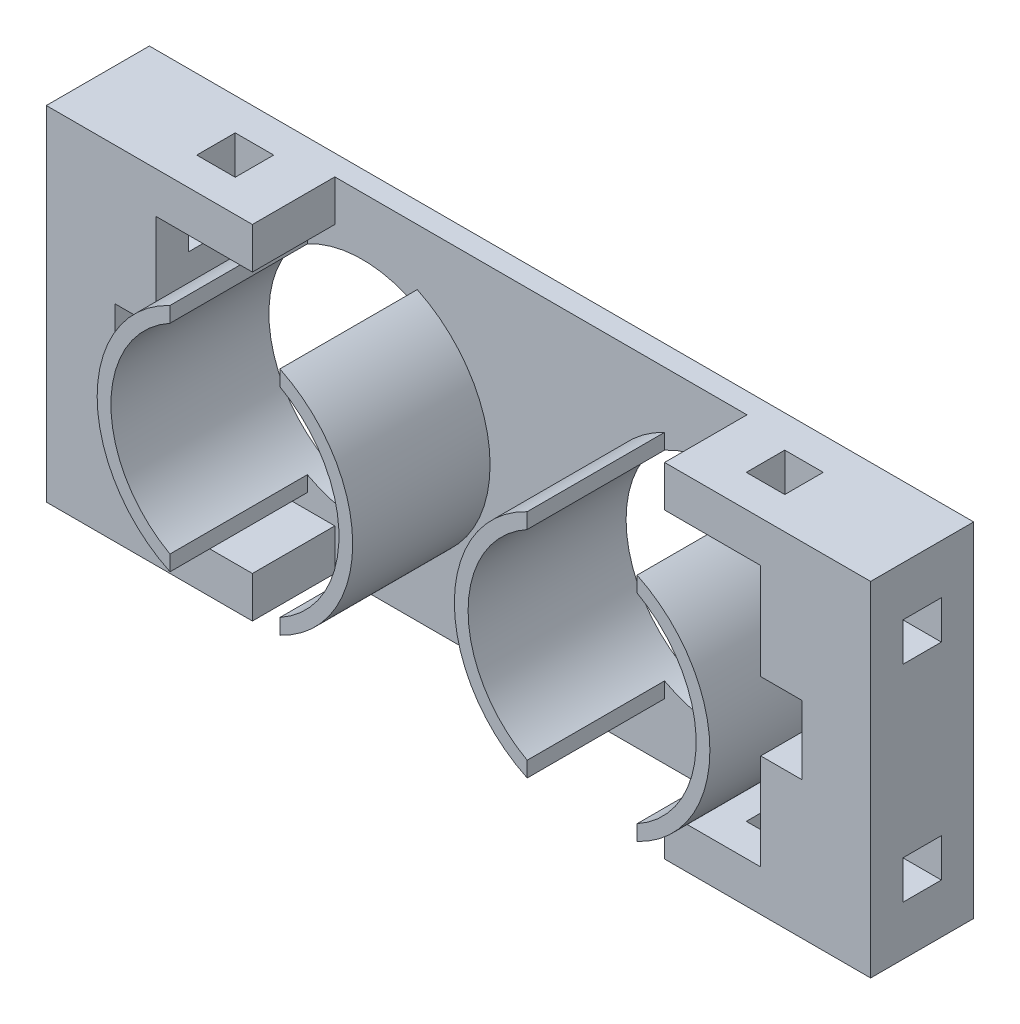
from build123d import *
from build123d.topology import SkipClean

# Parameters (mm, degrees)
ESBO_O1_R                = 8.3
RESSALTO_EXTRUS_O1_DEPTH = 1.5
RESSALTO_EXTRUS_O2_DEPTH = 6
ESBO_O3_W                = 2.8
ESBO_O3_H                = 2.8
CORTE_EXTRUS_O1_DEPTH    = 37.142080737
ESBO_O4_W                = 2.8
ESBO_O4_H                = 2.8
CORTE_EXTRUS_O2_DEPTH    = 53.08166664
ESBO_O6_W                = 5
ESBO_O6_H                = 25
RESSALTO_EXTRUS_O5_DEPTH = 7.5
ESBO_O7_W                = 2.8
ESBO_O7_H                = 2.8
CORTE_EXTRUS_O3_DEPTH    = 60
RESSALTO_EXTRUS_O3_DEPTH = 10


with BuildPart() as part:
    # Esboço1 → Ressalto-extrusão1 (new body)
    with BuildSketch(Plane.XY):
        Polygon((-25, -12.5), (-25, 12.5), (25, 12.5), (25, -12.5), (15, -12.5), (-15, -12.5), align=None)
        with Locations((-13, 0)):
            Circle(ESBO_O1_R, mode=Mode.SUBTRACT)
        with Locations(Location((13, 0, 0), (0, 0, 180))):
            Circle(ESBO_O1_R, mode=Mode.SUBTRACT)
    extrude(amount=RESSALTO_EXTRUS_O1_DEPTH)

    # Esboço2 → Ressalto-extrusão2 (add)
    with BuildSketch(Plane.XY.offset(1.5)):
        Polygon((-20, -12.5), (-25, -12.5), (-25, -2.5), (-22, -2.5), (-22, -9.5), (-15, -9.5), (-15, -12.5), align=None)
        Polygon((22, -2.5), (22, -9.5), (15, -9.5), (15, -12.5), (20, -12.5), (25, -12.5), (25, -2.5), align=None)
        Polygon((20, 12.5), (25, 12.5), (25, 2.5), (22, 2.5), (22, 9.5), (15, 9.5), (15, 12.5), align=None)
        Polygon((-22, 2.5), (-22, 9.5), (-15, 9.5), (-15, 12.5), (-20, 12.5), (-25, 12.5), (-25, 2.5), align=None)
    extrude(amount=RESSALTO_EXTRUS_O2_DEPTH)

    # Esboço3 → Corte-extrusão1 (cut, through all)
    with BuildSketch(Plane.XZ.offset(12.5)):
        with Locations((-20, 3.75)):
            Rectangle(ESBO_O3_W, ESBO_O3_H)
        with Locations((20, 3.75)):
            Rectangle(ESBO_O3_W, ESBO_O3_H)
    extrude(amount=-CORTE_EXTRUS_O1_DEPTH, mode=Mode.SUBTRACT)

    # Esboço4 → Corte-extrusão2 (cut, through all)
    with BuildSketch(Plane.ZY.offset(25)):
        with Locations((3.75, 7.5)):
            Rectangle(ESBO_O4_W, ESBO_O4_H)
        with Locations((3.75, -7.5)):
            Rectangle(ESBO_O4_W, ESBO_O4_H)
    extrude(amount=-CORTE_EXTRUS_O2_DEPTH, mode=Mode.SUBTRACT)

    # Esboço6 → Ressalto-extrusão5 (add)
    with BuildSketch(Plane(origin=(0, 0, 0), x_dir=(-1, 0, 0), z_dir=(0, 0, -1))):
        with Locations((-27.5, 0)):
            Rectangle(ESBO_O6_W, ESBO_O6_H)
        with Locations((27.5, 0)):
            Rectangle(ESBO_O6_W, ESBO_O6_H)
    extrude(amount=-RESSALTO_EXTRUS_O5_DEPTH)

    # Esboço7 → Corte-extrusão3 (cut)
    with BuildSketch(Plane(origin=(30, 0, 0), x_dir=(0, 0, -1), z_dir=(1, 0, 0))):
        with Locations((-3.75, -7.5)):
            Rectangle(ESBO_O7_W, ESBO_O7_H)
        with Locations((-3.75, 7.5)):
            Rectangle(ESBO_O7_W, ESBO_O7_H)
    extrude(amount=-CORTE_EXTRUS_O3_DEPTH, mode=Mode.SUBTRACT)

    # Esboço5 → Ressalto-extrusão3 (add)
    with SkipClean():  # the faces are left unmerged after this step: merging them gives an invalid solid
        with BuildSketch(Plane.XY.offset(1.5)):
            with BuildLine():
                Line((-9, -7.272551134), (-9, -8.395832299))
                ThreePointArc((-9, -8.395832299), (-3.7, 0), (-9, 8.395832299))
                Line((-9, 8.395832299), (-9, 7.272551134))
                ThreePointArc((-9, 7.272551134), (-4.7, 0), (-9, -7.272551134))
            make_face()
            with BuildLine():
                Line((-17, -7.272551134), (-17, -8.395832299))
                ThreePointArc((-17, -8.395832299), (-22.3, 0), (-17, 8.395832299))
                Line((-17, 8.395832299), (-17, 7.272551134))
                ThreePointArc((-17, 7.272551134), (-21.3, 0), (-17, -7.272551134))
            make_face()
            with BuildLine():
                Line((9, -7.272551134), (9, -8.395832299))
                ThreePointArc((9, -8.395832299), (3.7, 0), (9, 8.395832299))
                Line((9, 8.395832299), (9, 7.272551134))
                ThreePointArc((9, 7.272551134), (4.7, 0), (9, -7.272551134))
            make_face()
            with BuildLine():
                Line((17, 8.395832299), (17, 7.272551134))
                ThreePointArc((17, 7.272551134), (21.3, 0), (17, -7.272551134))
                Line((17, -7.272551134), (17, -8.395832299))
                ThreePointArc((17, -8.395832299), (22.3, 0), (17, 8.395832299))
            make_face()
        extrude(amount=RESSALTO_EXTRUS_O3_DEPTH)


solid = part.part
